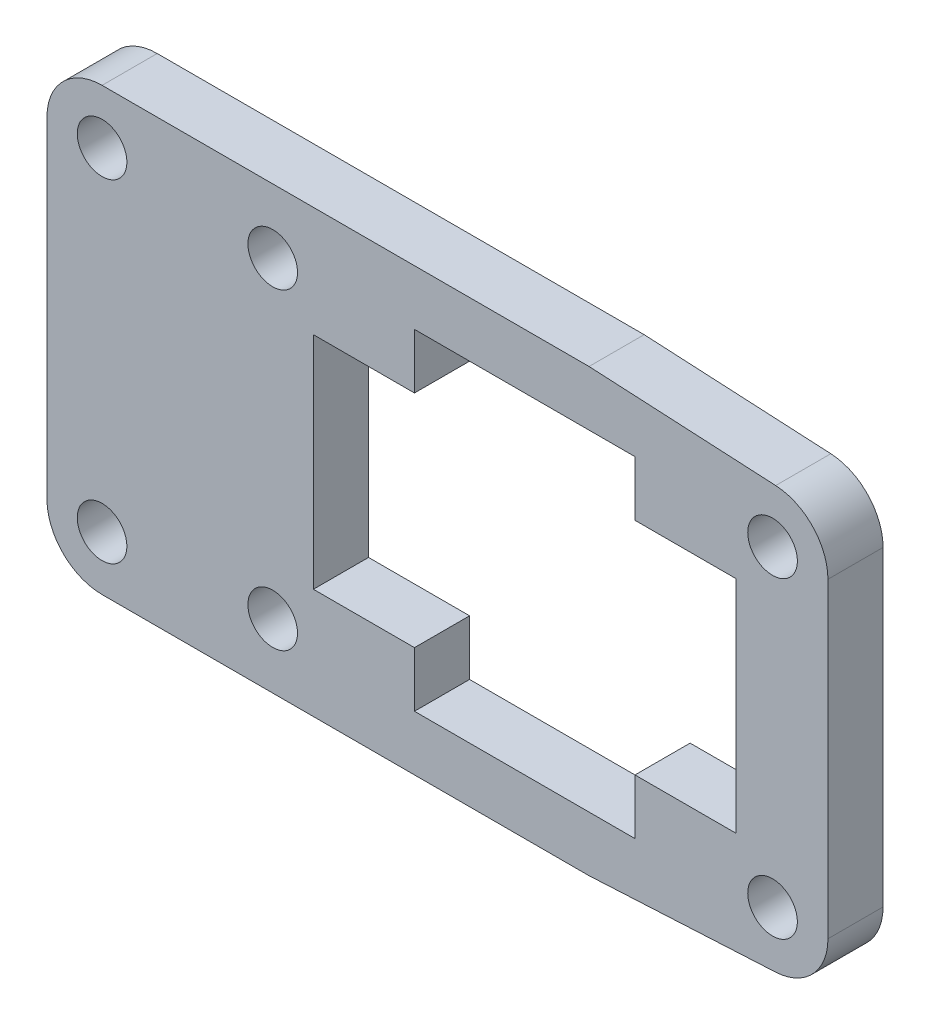
from build123d import *

# Parameters (mm, degrees)
SKETCH_1_R      = 1.35
EXTRUDE_1_DEPTH = 3


with BuildPart() as part:
    # 草图1 → 凸台-拉伸1 (new body)
    with BuildSketch(Plane.XY.offset(3)):
        with BuildLine():
            Line((-15.657318156, 20.9998), (-15.657318156, 3))
            ThreePointArc((-15.657318156, 3), (-14.7786385, 0.878679656), (-12.657318156, 0))
            Line((-12.657318156, 0), (13.843681844, 0))
            Line((13.843681844, 0), (24.001386189, 0.533010723))
            ThreePointArc((24.001386189, 0.533010723), (26.020372671, 1.463896655), (26.844181844, 3.528889024))
            Line((26.844181844, 3.528889024), (26.844181844, 20.471910982))
            ThreePointArc((26.844181844, 20.471910982), (26.020271299, 22.537010177), (24.001092054, 23.467804703))
            Line((24.001092054, 23.467804703), (13.843681844, 23.9998))
            Line((13.843681844, 23.9998), (-12.657318156, 23.9998))
            ThreePointArc((-12.657318156, 23.9998), (-14.7786385, 23.121120344), (-15.657318156, 20.9998))
        make_face()
        with Locations(Location((-3.370069198, 3.501148349, 0), (0, 0, 180))):
            Circle(SKETCH_1_R, mode=Mode.SUBTRACT)
        with Locations(Location((-3.370069198, 20.498351651, 0), (0, 0, 180))):
            Circle(SKETCH_1_R, mode=Mode.SUBTRACT)
        with Locations(Location((23.829980802, 3.501148349, 0), (0, 0, 180))):
            Circle(SKETCH_1_R, mode=Mode.SUBTRACT)
        with Locations(Location((23.829980802, 20.498351651, 0), (0, 0, 180))):
            Circle(SKETCH_1_R, mode=Mode.SUBTRACT)
        with Locations(Location((-12.657468156, 21.049, 0), (0, 0, 180))):
            Circle(SKETCH_1_R, mode=Mode.SUBTRACT)
        with Locations(Location((-12.657468156, 2.95, 0), (0, 0, 180))):
            Circle(SKETCH_1_R, mode=Mode.SUBTRACT)
        Polygon((4.343381844, 17.9998), (4.343381844, 20.9998), (16.343381844, 20.9998), (16.343381844, 17.9998), (21.843181844, 17.9998), (21.843181844, 6), (16.343381844, 6), (16.343381844, 3), (4.343381844, 3), (4.343381844, 6), (-1.156518156, 6), (-1.156518156, 17.9998), align=None, mode=Mode.SUBTRACT)
    extrude(amount=-EXTRUDE_1_DEPTH)


solid = part.part
